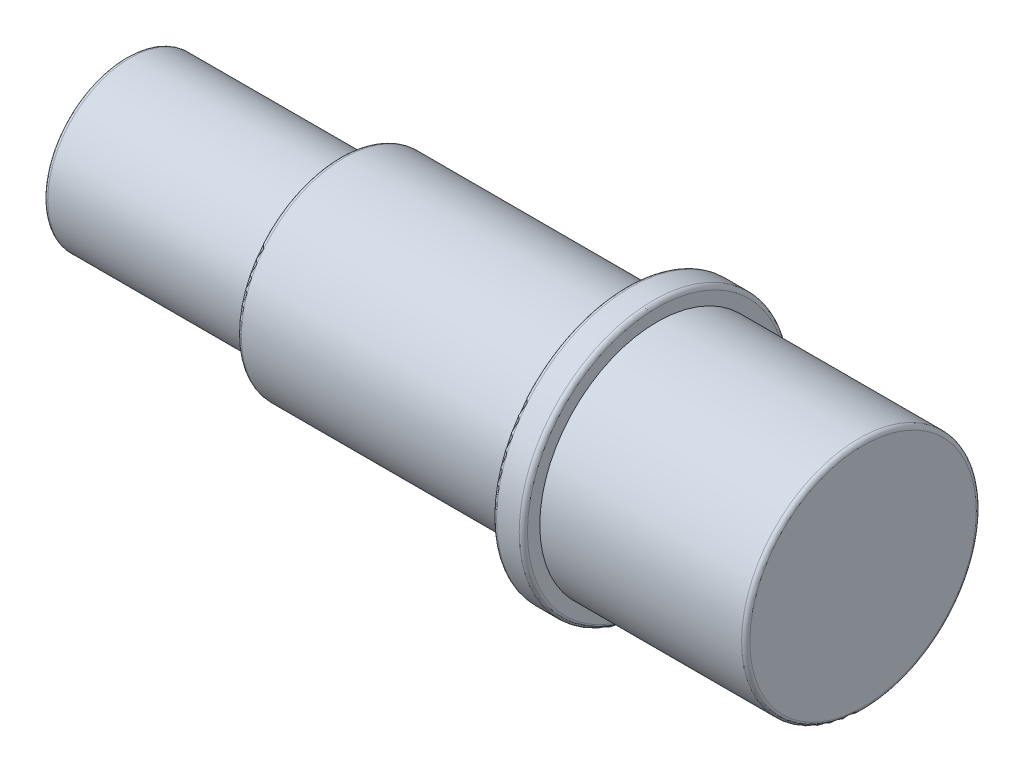
from build123d import *

# Parameters (mm, degrees)
HOLE_WIZARD_M81_D     = 6.8
HOLE_WIZARD_M81_DEPTH = 22.25
HOLE_WIZARD_M81_TIP   = 2.042926105
FILLET_1_R            = 1


with BuildPart() as part:
    # Эскиз1 → Повернуть1 (revolve)
    with BuildSketch(Plane.XY, mode=Mode.PRIVATE) as revolve_1_sk:
        Polygon((0, 0), (0, 20), (52, 20), (52, 25), (121.5, 25), (121.5, 32.5), (129, 32.5), (129, 28.5), (179, 28.5), (179, 0), align=None)
    revolve(revolve_1_sk.sketch.rotate(Axis((0, 0, 0), (1, 0, 0)), 90), axis=Axis((0, 0, 0), (1, 0, 0)))

    # Отверстие обработанное метчиком M81
    with Locations(Plane.ZY):
        with Locations((0, 0)):
            Hole(HOLE_WIZARD_M81_D / 2, depth=HOLE_WIZARD_M81_DEPTH)
            with Locations((0, 0, -(HOLE_WIZARD_M81_DEPTH + HOLE_WIZARD_M81_TIP / 2))):  # 118° drill point
                Cone(0, HOLE_WIZARD_M81_D / 2, HOLE_WIZARD_M81_TIP, mode=Mode.SUBTRACT)

    # Скругление1
    fillet_1_edges = [part.edges().sort_by_distance(p)[0] for p in [
        (52, 0, -25),
        (0, 0, -20),
        (179, 0, -28.5),
        (129, 0, -32.5),
        (121.5, 0, -32.5),
    ]]
    fillet(fillet_1_edges, radius=FILLET_1_R)


solid = part.part
